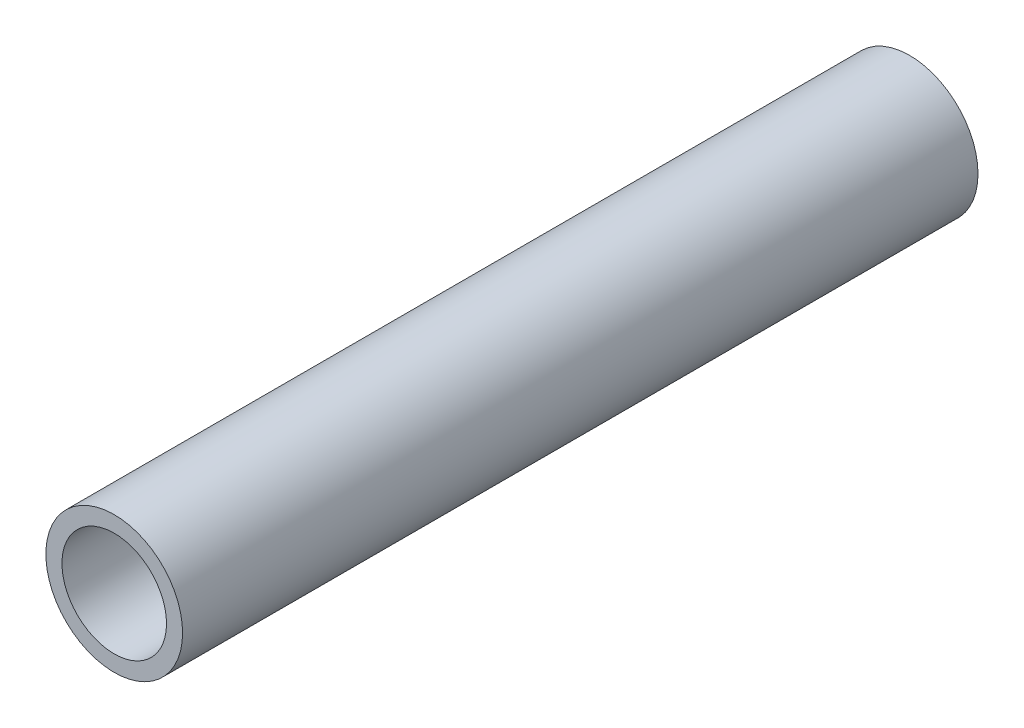
from build123d import *

# Parameters (mm, degrees)
SCHIZZO1_R                   = 4.25
SCHIZZO1_R_2                 = 3.25
ESTRUSIONE_ESTRUSIONE1_DEPTH = 49.45


with BuildPart() as part:
    # Schizzo1 → Estrusione-Estrusione1 (new body)
    with BuildSketch(Plane.XY):
        Circle(SCHIZZO1_R)
        Circle(SCHIZZO1_R_2, mode=Mode.SUBTRACT)
    extrude(amount=ESTRUSIONE_ESTRUSIONE1_DEPTH)


solid = part.part
